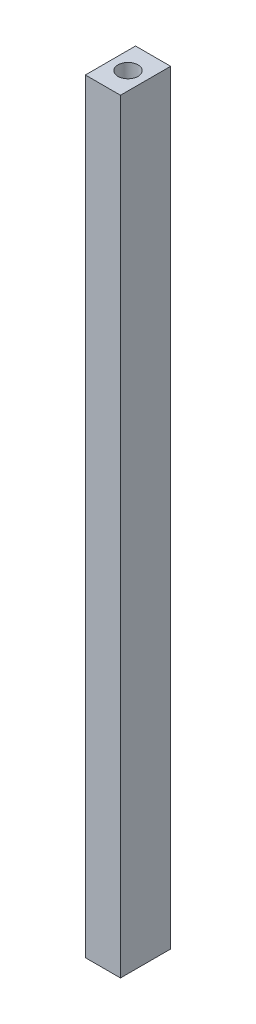
from build123d import *

# Parameters (mm, degrees)
SKETCH1_W           = 7
SKETCH1_H           = 10
BOSS_EXTRUDE1_DEPTH = 76.2
SKETCH6_R           = 2
CUT_EXTRUDE3_DEPTH  = 13


with BuildPart() as part:
    # Sketch1 → Boss-Extrude1 (new, symmetric)
    with BuildSketch(Plane(origin=(0, 0, 0), x_dir=(1, 0, 0), z_dir=(0, 1, 0))):
        Rectangle(SKETCH1_W, SKETCH1_H)
    extrude(amount=BOSS_EXTRUDE1_DEPTH, both=True)

    # Sketch6 → Cut-Extrude3 (cut)
    with BuildSketch(Plane.XZ.offset(76.2)):
        with Locations(Location((0, 0, 0), (0, 0, 270))):
            Circle(SKETCH6_R)
    cut_extrude3 = extrude(amount=-CUT_EXTRUDE3_DEPTH, mode=Mode.SUBTRACT)

    # Mirror1: Cut-Extrude3 across plane
    add(cut_extrude3.mirror(Plane.ZX), mode=Mode.SUBTRACT)


solid = part.part
